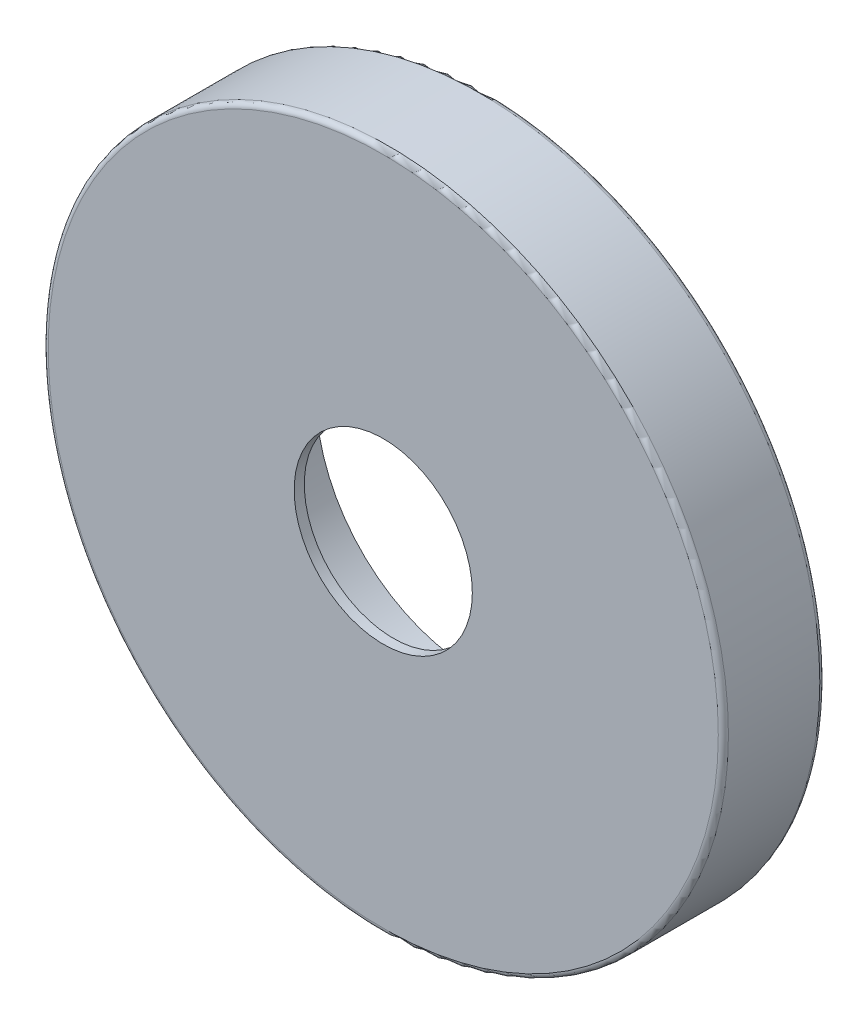
from build123d import *

# Parameters (mm, degrees)
SKETCH_1_R          = 67
SKETCH_1_R_2        = 17.55
EXTRUDE_1_DEPTH     = 2
EXTRUDE_START       = 18
SKETCH_2_R          = 67
SKETCH_2_R_2        = 31.2
EXTRUDE_2_DEPTH     = 18
FILLET_1_R          = 1
SHELL_4_T           = -2.5
SKETCH_4_R          = 0.85
EXTRUDE_3_DEPTH     = 18
FILLET_2_R          = 1
CUT_EXTRUDE_1_DEPTH = 1.2
SKETCH_6_R          = 64.5
CUT_EXTRUDE_2_DEPTH = 2


with BuildPart() as part:
    # 草图1 → 凸台-拉伸1 (new body)
    with BuildSketch(Plane.XY):
        Circle(SKETCH_1_R)
        Circle(SKETCH_1_R_2, mode=Mode.SUBTRACT)
    extrude(amount=EXTRUDE_1_DEPTH)

    # 草图2 → 凸台-拉伸2 (add)
    with BuildSketch(Plane(origin=(0, 0, 0), x_dir=(-1, 0, 0), z_dir=(0, 0, -1)).offset(EXTRUDE_START)):
        Circle(SKETCH_2_R)
        Circle(SKETCH_2_R_2, mode=Mode.SUBTRACT)
    extrude(amount=-EXTRUDE_2_DEPTH)

    # 圆角1
    fillet_1_edges = [part.edges().sort_by_distance(p)[0] for p in [
        (-67, 0, 2),
    ]]
    fillet(fillet_1_edges, radius=FILLET_1_R)

    # 抽壳4
    shell_4_openings = [part.faces().sort_by_distance(p)[0] for p in [
        (65.104953826, 0, -18),
    ]]
    offset(amount=SHELL_4_T, openings=shell_4_openings, kind=Kind.INTERSECTION)

    # 草图4 → 凸台-拉伸3 (add)
    # profile 1 of 6: a face of its own
    with BuildSketch(Plane(origin=(0, 0, 0), x_dir=(-1, 0, 0), z_dir=(0, 0, -1)).offset(EXTRUDE_START)):
        with BuildLine():
            Line((-41.05741952, 49.744731403), (-20.030225152, 27.101292964))
            ThreePointArc((-20.030225152, 27.101292964), (-23.785423834, 23.873491848), (-27.027081181, 20.130247958))
            Line((-27.027081181, 20.130247958), (-49.744731403, 41.05741952))
            ThreePointArc((-49.744731403, 41.05741952), (-45.608387387, 45.608387387), (-41.05741952, 49.744731403))
        make_face()
        with Locations(Location((-34, 34, 0), (0, 0, 180))):
            Circle(SKETCH_4_R, mode=Mode.SUBTRACT)
    # profile 2 of 6: a face of its own
    with BuildSketch(Plane(origin=(0, 0, 0), x_dir=(-1, 0, 0), z_dir=(0, 0, -1)).offset(EXTRUDE_START)):
        with BuildLine():
            Line((22.55149134, 60.42913402), (13.455295606, 30.897330308))
            ThreePointArc((13.455295606, 30.897330308), (8.782338501, 32.535527204), (3.919765525, 33.471262872))
            Line((3.919765525, 33.471262872), (10.684402617, 63.608910859))
            ThreePointArc((10.684402617, 63.608910859), (16.693828409, 62.302215796), (22.55149134, 60.42913402))
        make_face()
        with Locations(Location((12.444863729, 46.444863729, 0), (0, 0, 180))):
            Circle(SKETCH_4_R, mode=Mode.SUBTRACT)
    # profile 3 of 6: a face of its own
    with BuildSketch(Plane(origin=(0, 0, 0), x_dir=(-1, 0, 0), z_dir=(0, 0, -1)).offset(EXTRUDE_START)):
        with BuildLine():
            Line((63.608910859, 10.684402617), (33.485520759, 3.796037343))
            ThreePointArc((33.485520759, 3.796037343), (32.567762335, 8.662035356), (30.946846706, 13.341014914))
            Line((30.946846706, 13.341014914), (60.42913402, 22.55149134))
            ThreePointArc((60.42913402, 22.55149134), (62.302215796, 16.693828409), (63.608910859, 10.684402617))
        make_face()
        with Locations(Location((46.444863729, 12.444863729, 0), (0, 0, 180))):
            Circle(SKETCH_4_R, mode=Mode.SUBTRACT)
    # profile 4 of 6: a face of its own
    with BuildSketch(Plane(origin=(0, 0, 0), x_dir=(-1, 0, 0), z_dir=(0, 0, -1)).offset(EXTRUDE_START)):
        with BuildLine():
            Line((41.05741952, -49.744731403), (20.030225152, -27.101292964))
            ThreePointArc((20.030225152, -27.101292964), (23.785423834, -23.873491848), (27.027081181, -20.130247958))
            Line((27.027081181, -20.130247958), (49.744731403, -41.05741952))
            ThreePointArc((49.744731403, -41.05741952), (45.608387387, -45.608387387), (41.05741952, -49.744731403))
        make_face()
        with Locations(Location((34, -34, 0), (0, 0, 180))):
            Circle(SKETCH_4_R, mode=Mode.SUBTRACT)
    # profile 5 of 6: a face of its own
    with BuildSketch(Plane(origin=(0, 0, 0), x_dir=(-1, 0, 0), z_dir=(0, 0, -1)).offset(EXTRUDE_START)):
        with BuildLine():
            Line((-22.55149134, -60.42913402), (-13.455295606, -30.897330308))
            ThreePointArc((-13.455295606, -30.897330308), (-8.782338501, -32.535527204), (-3.919765525, -33.471262872))
            Line((-3.919765525, -33.471262872), (-10.684402617, -63.608910859))
            ThreePointArc((-10.684402617, -63.608910859), (-16.693828409, -62.302215796), (-22.55149134, -60.42913402))
        make_face()
        with Locations(Location((-12.444863729, -46.444863729, 0), (0, 0, 180))):
            Circle(SKETCH_4_R, mode=Mode.SUBTRACT)
    # profile 6 of 6: a face of its own
    with BuildSketch(Plane(origin=(0, 0, 0), x_dir=(-1, 0, 0), z_dir=(0, 0, -1)).offset(EXTRUDE_START)):
        with BuildLine():
            Line((-63.608910859, -10.684402617), (-33.485520759, -3.796037343))
            ThreePointArc((-33.485520759, -3.796037343), (-32.567762335, -8.662035356), (-30.946846706, -13.341014914))
            Line((-30.946846706, -13.341014914), (-60.42913402, -22.55149134))
            ThreePointArc((-60.42913402, -22.55149134), (-62.302215796, -16.693828409), (-63.608910859, -10.684402617))
        make_face()
        with Locations(Location((-46.444863729, -12.444863729, 0), (0, 0, 180))):
            Circle(SKETCH_4_R, mode=Mode.SUBTRACT)
    extrude(amount=-EXTRUDE_3_DEPTH)

    # 圆角2
    fillet_2_edges = [part.edges().sort_by_distance(p)[0] for p in [
        (67, 0, -18),
    ]]
    fillet(fillet_2_edges, radius=FILLET_2_R)

    # 草图5 → 切除-拉伸1 (cut)
    with BuildSketch(Plane(origin=(0, 0, -0.5), x_dir=(-1, 0, 0), z_dir=(0, 0, -1))):
        with BuildLine():
            Line((-63.608910859, -10.684402617), (-33.485520759, -3.796037343))
            ThreePointArc((-33.485520759, -3.796037343), (-32.535527204, 8.782338501), (-27.027081181, 20.130247958))
            Line((-27.027081181, 20.130247958), (-49.744731403, 41.05741952))
            ThreePointArc((-49.744731403, 41.05741952), (-62.302215796, 16.693828409), (-63.608910859, -10.684402617))
        make_face()
        with BuildLine():
            Line((-41.05741952, 49.744731403), (-20.030225152, 27.101292964))
            ThreePointArc((-20.030225152, 27.101292964), (-8.662035356, 32.567762335), (3.919765525, 33.471262872))
            Line((3.919765525, 33.471262872), (10.684402617, 63.608910859))
            ThreePointArc((10.684402617, 63.608910859), (-16.693828409, 62.302215796), (-41.05741952, 49.744731403))
        make_face()
        with BuildLine():
            Line((30.946846706, 13.341014914), (60.42913402, 22.55149134))
            ThreePointArc((60.42913402, 22.55149134), (45.608387387, 45.608387387), (22.55149134, 60.42913402))
            Line((22.55149134, 60.42913402), (13.455295606, 30.897330308))
            ThreePointArc((13.455295606, 30.897330308), (23.873491848, 23.785423834), (30.946846706, 13.341014914))
        make_face()
        with BuildLine():
            Line((27.027081181, -20.130247958), (49.744731403, -41.05741952))
            ThreePointArc((49.744731403, -41.05741952), (62.302215796, -16.693828409), (63.608910859, 10.684402617))
            Line((63.608910859, 10.684402617), (33.485520759, 3.796037343))
            ThreePointArc((33.485520759, 3.796037343), (32.535527204, -8.782338501), (27.027081181, -20.130247958))
        make_face()
        with BuildLine():
            Line((-3.919765525, -33.471262872), (-10.684402617, -63.608910859))
            ThreePointArc((-10.684402617, -63.608910859), (16.693828409, -62.302215796), (41.05741952, -49.744731403))
            Line((41.05741952, -49.744731403), (20.030225152, -27.101292964))
            ThreePointArc((20.030225152, -27.101292964), (8.662035356, -32.567762335), (-3.919765525, -33.471262872))
        make_face()
        with BuildLine():
            Line((-30.946846706, -13.341014914), (-60.42913402, -22.55149134))
            ThreePointArc((-60.42913402, -22.55149134), (-45.608387387, -45.608387387), (-22.55149134, -60.42913402))
            Line((-22.55149134, -60.42913402), (-13.455295606, -30.897330308))
            ThreePointArc((-13.455295606, -30.897330308), (-23.873491848, -23.785423834), (-30.946846706, -13.341014914))
        make_face()
    extrude(amount=-CUT_EXTRUDE_1_DEPTH, mode=Mode.SUBTRACT)

    # 草图6 → 切除-拉伸2 (cut)
    with BuildSketch(Plane(origin=(0, 0, -18), x_dir=(-1, 0, 0), z_dir=(0, 0, -1))):
        Circle(SKETCH_6_R)
    extrude(amount=-CUT_EXTRUDE_2_DEPTH, mode=Mode.SUBTRACT)


solid = part.part
